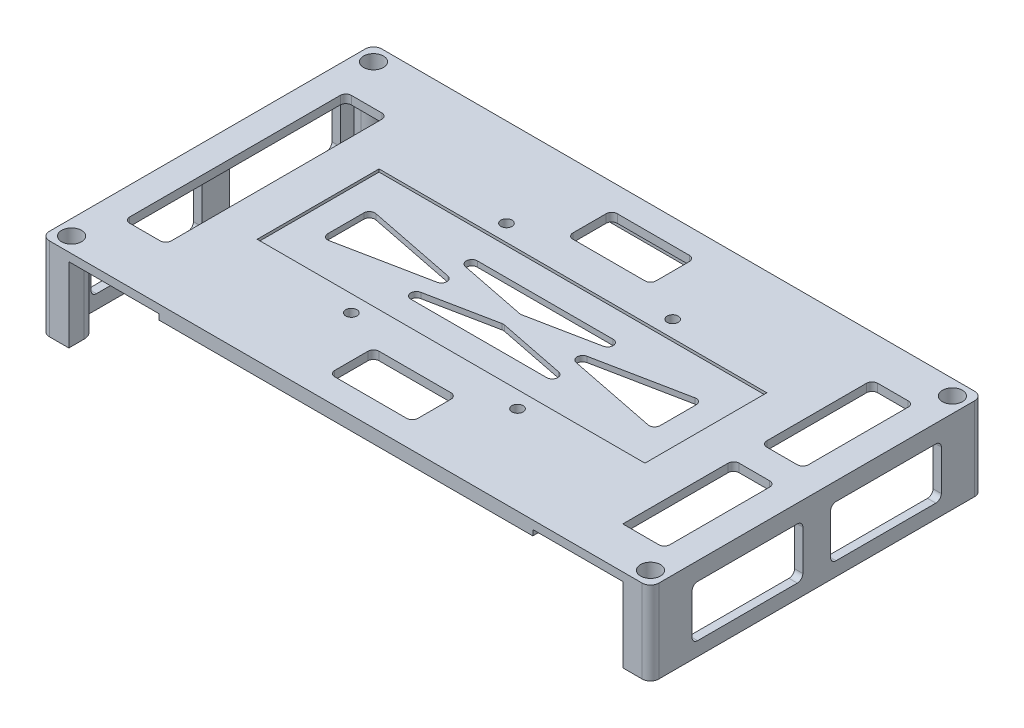
from build123d import *

# Parameters (mm, degrees)
SKETCH_8_W               = 220
SKETCH_8_H               = 120
EXTRUDE_6_DEPTH          = 3
SKETCH_10_W              = 10
SKETCH_10_H              = 120
EXTRUDE_7_DEPTH          = 27
CUT_EXTRUDE_1_DEPTH      = 129.175660716
CUT_EXTRUDE_1_DEPTH_BACK = 129.175660716
SKETCH_9_R               = 2.05
SKETCH_11_R              = 3.6
CUT_EXTRUDE_2_DEPTH      = 22
CUT_EXTRUDE_4_DEPTH      = 129.175660716
CUT_EXTRUDE_4_DEPTH_BACK = 129.175660716
SKETCH_13_W              = 40
SKETCH_13_H              = 18.5
SKETCH_14_W              = 140
SKETCH_14_H              = 44
CUT_EXTRUDE_7_DEPTH      = 1
SKETCH_15_W              = 15
SKETCH_15_H              = 80
SKETCH_15_H_2            = 40
SKETCH_15_W_2            = 30
SKETCH_15_H_3            = 16
CUT_EXTRUDE_8_DEPTH      = 129.840987267
SKETCH_9_5_R             = 2
CUT_EXTRUDE_9_DEPTH      = 129.175660716
CUT_EXTRUDE_13_DEPTH     = 27
SKETCH_20_W              = 135
SKETCH_20_H              = 8
EXTRUDE_8_DEPTH          = 2
FILLET_1_R               = 3
FILLET_2_R               = 2


with BuildPart() as part:
    # 草圖8 → 填料-伸長6 (new body)
    with BuildSketch(Plane(origin=(0, 0, 0), x_dir=(1, 0, 0), z_dir=(0, 1, 0))):
        Rectangle(SKETCH_8_W, SKETCH_8_H)
    extrude(amount=EXTRUDE_6_DEPTH)

    # 草圖10 → 填料-伸長7 (add)
    with BuildSketch(Plane.XZ):
        with Locations((-105, 0)):
            Rectangle(SKETCH_10_W, SKETCH_10_H)
        with Locations((105, 0)):
            Rectangle(SKETCH_10_W, SKETCH_10_H)
    extrude(amount=EXTRUDE_7_DEPTH)

    # 草圖9 → 除料-伸長1 (cut, two sides: drawn at the far end of the back side and taken through both)
    with BuildSketch(Plane(origin=(0, 0, 0), x_dir=(1, 0, 0), z_dir=(0, 1, 0)).offset(-CUT_EXTRUDE_1_DEPTH_BACK)):
        with Locations((104.5, 54.5)):
            Circle(SKETCH_9_R)
        with Locations((-104.5, 54.5)):
            Circle(SKETCH_9_R)
        with Locations((-104.5, -54.5)):
            Circle(SKETCH_9_R)
        with Locations((104.5, -54.5)):
            Circle(SKETCH_9_R)
    extrude(amount=CUT_EXTRUDE_1_DEPTH + CUT_EXTRUDE_1_DEPTH_BACK, mode=Mode.SUBTRACT)

    # 草圖11 → 除料-伸長2 (cut)
    with BuildSketch(Plane(origin=(0, 3, 0), x_dir=(1, 0, 0), z_dir=(0, 1, 0))):
        with Locations((-104.497380754, 54.5)):
            Circle(SKETCH_11_R)
        with Locations((-104.497380754, -54.5)):
            Circle(SKETCH_11_R)
        with Locations((104.5, -54.5)):
            Circle(SKETCH_11_R)
        with Locations((104.5, 54.5)):
            Circle(SKETCH_11_R)
    extrude(amount=-CUT_EXTRUDE_2_DEPTH, mode=Mode.SUBTRACT)

    # 草圖13 → 除料-伸長4 (cut, two sides: drawn at the far end of the back side and taken through both)
    with BuildSketch(Plane(origin=(0, 0, 0), x_dir=(0, 0, -1), z_dir=(1, 0, 0)).offset(-CUT_EXTRUDE_4_DEPTH_BACK)):
        with Locations((-25, -12.75)):
            Rectangle(SKETCH_13_W, SKETCH_13_H)
        with Locations((25, -12.75)):
            Rectangle(SKETCH_13_W, SKETCH_13_H)
    extrude(amount=CUT_EXTRUDE_4_DEPTH + CUT_EXTRUDE_4_DEPTH_BACK, mode=Mode.SUBTRACT)

    # 草圖14 → 除料-伸長7 (cut)
    with BuildSketch(Plane(origin=(0, 3, 0), x_dir=(1, 0, 0), z_dir=(0, 1, 0))):
        Rectangle(SKETCH_14_W, SKETCH_14_H)
    extrude(amount=-CUT_EXTRUDE_7_DEPTH, mode=Mode.SUBTRACT)

    # 草圖15 → 除料-伸長8 (cut, through all)
    with BuildSketch(Plane(origin=(0, 3, 0), x_dir=(1, 0, 0), z_dir=(0, 1, 0))):
        with Locations((-92.5, 0)):
            Rectangle(SKETCH_15_W, SKETCH_15_H)
        with Locations((92.5, 25)):
            Rectangle(SKETCH_15_W, SKETCH_15_H_2)
        Polygon((-44.702941459, -12), (44.702941459, -12), (0, -3.059411708), align=None)
        Polygon((-60, -8.940588292), (-60, 8.940588292), (-15.297058541, 0), align=None)
        Polygon((-44.702941459, 12), (44.702941459, 12), (0, 3.059411708), align=None)
        Polygon((60, -8.940588292), (60, 8.940588292), (15.297058541, 0), align=None)
        with Locations((0, -43)):
            Rectangle(SKETCH_15_W_2, SKETCH_15_H_3)
        with Locations((0, 43)):
            Rectangle(SKETCH_15_W_2, SKETCH_15_H_3)
        with Locations((92.5, -25)):
            Rectangle(SKETCH_15_W, SKETCH_15_H_2)
    extrude(amount=-CUT_EXTRUDE_8_DEPTH, mode=Mode.SUBTRACT)

    # 草圖9<5> → 除料-伸長9 (cut, through all)
    with BuildSketch(Plane(origin=(0, 0, 0), x_dir=(1, 0, 0), z_dir=(0, 1, 0))):
        with Locations((30, 28)):
            Circle(SKETCH_9_5_R)
        with Locations((-30, 28)):
            Circle(SKETCH_9_5_R)
        with Locations((30, -28)):
            Circle(SKETCH_9_5_R)
        with Locations((-30, -28)):
            Circle(SKETCH_9_5_R)
    extrude(amount=CUT_EXTRUDE_9_DEPTH, mode=Mode.SUBTRACT)

    # 草圖19 → 除料-伸長13 (cut)
    with BuildSketch(Plane.XZ.offset(27)):
        with BuildLine():
            Line((-100, 54.5), (-100, -54.5))
            ThreePointArc((-100, -54.5), (-101.318019485, -51.318019485), (-104.5, -50))
            Line((-104.5, -50), (-107, -50))
            Line((-107, -50), (-107, 50))
            Line((-107, 50), (-104.5, 50))
            ThreePointArc((-104.5, 50), (-101.318019485, 51.318019485), (-100, 54.5))
        make_face()
        with BuildLine():
            Line((100, 54.5), (100, -54.5))
            ThreePointArc((100, -54.5), (101.318019485, -51.318019485), (104.5, -50))
            Line((104.5, -50), (107, -50))
            Line((107, -50), (107, 50))
            Line((107, 50), (104.5, 50))
            ThreePointArc((104.5, 50), (101.318019485, 51.318019485), (100, 54.5))
        make_face()
    extrude(amount=-CUT_EXTRUDE_13_DEPTH, mode=Mode.SUBTRACT)

    # 草圖20 → 填料-伸長8 (add)
    with BuildSketch(Plane.XZ):
        with Locations((0, 56)):
            Rectangle(SKETCH_20_W, SKETCH_20_H)
        with Locations((0, -56)):
            Rectangle(SKETCH_20_W, SKETCH_20_H)
        Polygon((-59, 32.5), (-39, 32.5), (-39, 29.5), (-54, 29.5), (-54, 25), (-59, 25), align=None)
        Polygon((54, 29.5), (39, 29.5), (39, 32.5), (59, 32.5), (59, 25), (54, 25), align=None)
        Polygon((59, -32.5), (39, -32.5), (39, -29.5), (54, -29.5), (54, -25), (59, -25), align=None)
        Polygon((-54, -29.5), (-39, -29.5), (-39, -32.5), (-59, -32.5), (-59, -25), (-54, -25), align=None)
    extrude(amount=EXTRUDE_8_DEPTH)

    # 圓角1
    fillet_1_edges = [part.edges().sort_by_distance(p)[0] for p in [
        (-110, -12, 60),
        (-110, -12, -60),
        (110, -12, -60),
        (110, -12, 60),
    ]]
    fillet(fillet_1_edges, radius=FILLET_1_R)

    # 圓角2
    fillet_2_edges = [part.edges().sort_by_distance(p)[0] for p in [
        (-107, 0, 0),
        (107, 0, 0),
        (108.5, -3.5, -5),
        (108.5, -3.5, 45),
        (108.5, -22, 45),
        (108.5, -22, -5),
        (108.5, -3.5, -45),
        (108.5, -3.5, 5),
        (108.5, -22, 5),
        (108.5, -22, -45),
        (-108.5, -22, -45),
        (-108.5, -22, 5),
        (-108.5, -3.5, -45),
        (-108.5, -3.5, 5),
        (-108.5, -22, 45),
        (-108.5, -3.5, 45),
        (-108.5, -3.5, -5),
        (-108.5, -22, -5),
        (60, 1, -8.940588292),
        (44.702941459, 1, -12),
        (-44.702941459, 1, -12),
        (0, 1, 3.059411708),
        (-44.702941459, 1, 12),
        (44.702941459, 1, 12),
        (-15.297058541, 1, 0),
        (0, 1, -3.059411708),
        (60, 1, 8.940588292),
        (100, 1.5, -5),
        (15, 1.5, -35),
        (100, 1.5, 45),
        (15, 1.5, 51),
        (-85, 1.5, 40),
        (-15, 1.5, 51),
        (85, 1.5, -5),
        (15.297058541, 1, 0),
        (-100, 1.5, 40),
        (-15, 1.5, -35),
        (-60, 1, 8.940588292),
        (-60, 1, -8.940588292),
        (15, 1.5, 35),
        (-15, 1.5, 35),
        (85, 1.5, 5),
        (85, 1.5, -45),
        (100, 1.5, 5),
        (100, 1.5, -45),
        (15, 1.5, -51),
        (-15, 1.5, -51),
        (-85, 1.5, -40),
        (-100, 1.5, -40),
    ]]
    fillet(fillet_2_edges, radius=FILLET_2_R)


solid = part.part
